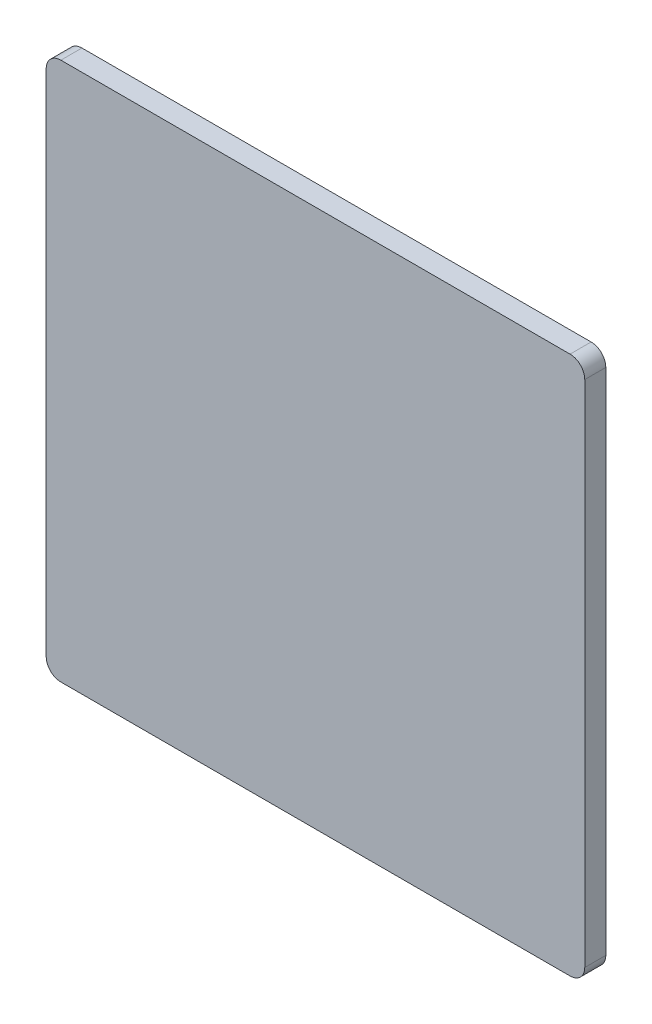
from build123d import *

# Parameters (mm, degrees)
SKETCH_1_W      = 110
SKETCH_1_H      = 110
EXTRUDE_1_DEPTH = 4.3
FILLET_1_R      = 3


with BuildPart() as part:
    # 草图1 → 凸台-拉伸1 (new body)
    with BuildSketch(Plane.XY):
        Rectangle(SKETCH_1_W, SKETCH_1_H)
    extrude(amount=EXTRUDE_1_DEPTH)

    # 圆角1
    fillet_1_edges = [part.edges().sort_by_distance(p)[0] for p in [
        (55, -55, 2.15),
        (-55, -55, 2.15),
        (-55, 55, 2.15),
        (55, 55, 2.15),
    ]]
    fillet(fillet_1_edges, radius=FILLET_1_R)


solid = part.part
